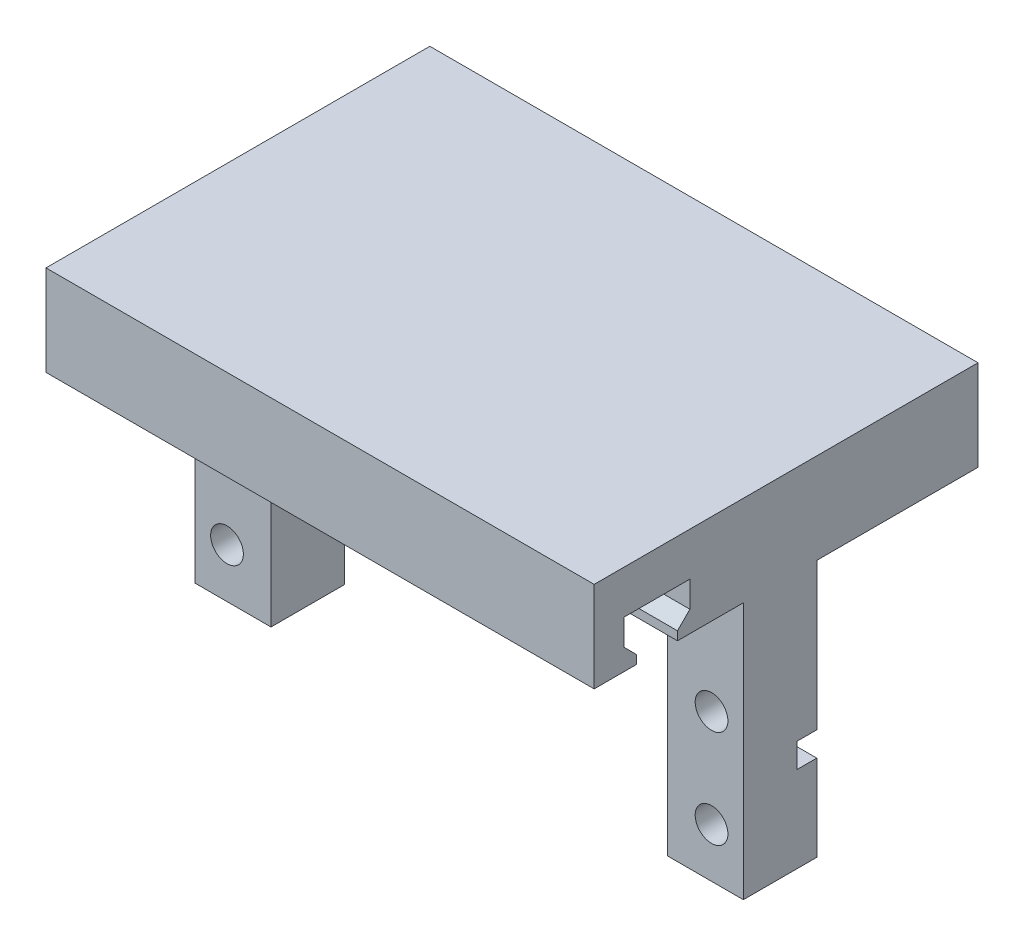
from build123d import *

# Parameters (mm, degrees)
BOSS_EXTRUDE1_DEPTH = 56
BOSS_EXTRUDE2_DEPTH = 56
CUT_EXTRUDE1_REACH  = 74.056
SKETCH6_R           = 1.672
CUT_EXTRUDE4_DEPTH  = 7.5


with BuildPart() as part:
    # Sketch2 → Boss-Extrude1 (new body)
    with BuildSketch(Plane(origin=(0, 0, 0), x_dir=(0, 0, -1), z_dir=(1, 0, 0))):
        Polygon((-39.250001311, 38.490001112), (-39.250001311, 29.240000993), (-34.930501133, 29.240000993), (-34.930501133, 30.129000545), (-36.200501025, 31.399000436), (-36.200501025, 34.065999091), (-29.469501227, 34.065999091), (-29.469501227, 31.399000436), (-30.739501119, 30.129000545), (-30.739501119, 29.240000993), (-0.03858842, 29.240000993), (-0.03858842, 38.490001112), align=None)
    extrude(amount=BOSS_EXTRUDE1_DEPTH)

    # Sketch3 → Boss-Extrude2 (add)
    with BuildSketch(Plane(origin=(56, 0, 0), x_dir=(0, 0, -1), z_dir=(1, 0, 0))):
        Polygon((-18.510001311, 29.240000993), (-24.010001311, 29.240000993), (-24.010001311, 2.969290993), (-16.510001311, 2.969290993), (-16.510001311, 11.750000993), (-18.510001311, 11.750000993), (-18.510001311, 14.250000993), (-16.510001311, 14.250000993), (-16.510001311, 29.240000993), align=None)
    extrude(amount=-BOSS_EXTRUDE2_DEPTH)

    # Cut-Extrude1: up to this face of the body (flat: up to its plane)
    cut_extrude1_end = Plane(part.part.faces().sort_by_distance((28, 21.745000993, 16.510001311))[0])
    # Sketch4 → Cut-Extrude1 (cut, up to the picked face)
    with BuildSketch(Plane.XY.offset(24.010001311), mode=Mode.PRIVATE) as cut_extrude1_sk1:
        Polygon((48.254, 23.631000993), (26.180665343, 23.631000993), (7.746, 23.631000993), (7.746, 20.223656135), (7.746, 7.540175529), (7.746, 2.969290993), (48.254, 2.969290993), (48.254, 20.898309359), align=None)
    cut_extrude1_tool1 = split(extrude(cut_extrude1_sk1.sketch, amount=-CUT_EXTRUDE1_REACH, mode=Mode.PRIVATE), bisect_by=cut_extrude1_end, keep=Keep.BOTH, mode=Mode.PRIVATE)
    add(cut_extrude1_tool1.solids().sort_by(Axis((28, 13.300146, 24.010001), (0, 0, -1)))[0], mode=Mode.SUBTRACT)

    # Sketch6 → Cut-Extrude4 (cut)
    with BuildSketch(Plane.XY.offset(24.010001311)):
        with Locations((3.25, 18.000000993)):
            Circle(SKETCH6_R)
        with Locations((3.25, 8.000000993)):
            Circle(SKETCH6_R)
        with Locations((52.75, 18.000000993)):
            Circle(SKETCH6_R)
        with Locations((52.75, 8.000000993)):
            Circle(SKETCH6_R)
    extrude(amount=-CUT_EXTRUDE4_DEPTH, mode=Mode.SUBTRACT)


solid = part.part
